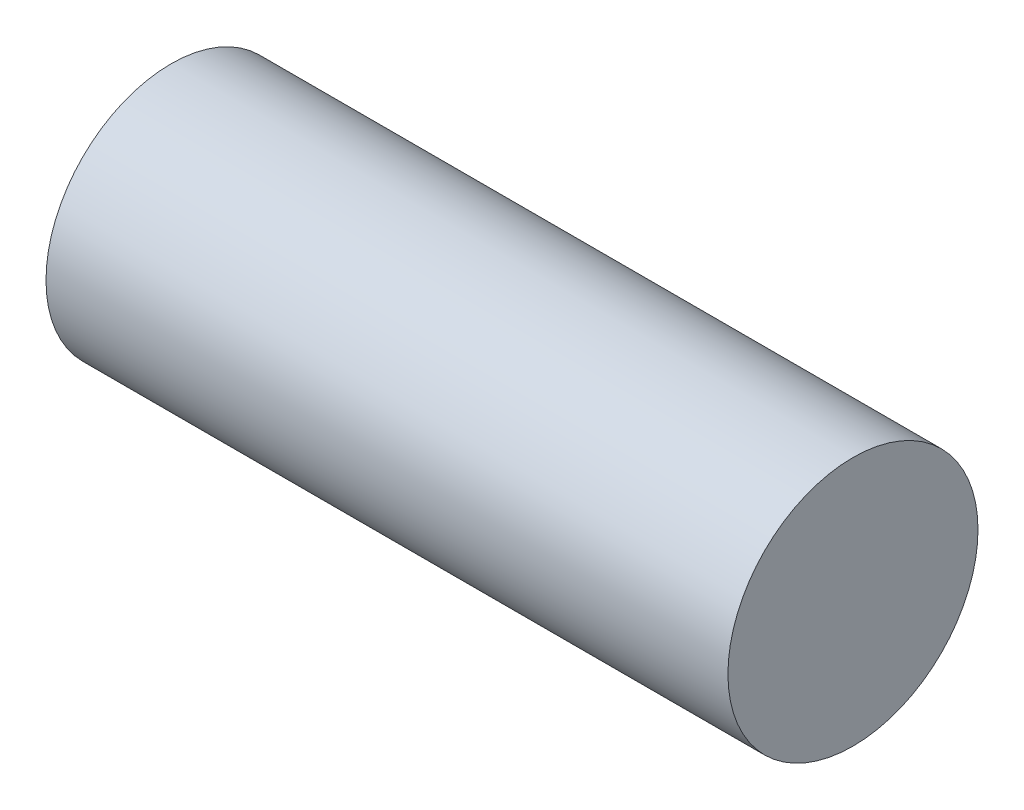
from build123d import *

# Parameters (mm, degrees)
SKETCH1_R           = 38.1
BOSS_EXTRUDE1_DEPTH = 210
CUT_EXTRUDE1_START  = -2.2
SKETCH2_R           = 38.1
CUT_EXTRUDE1_DEPTH  = 2.2


with BuildPart() as part:
    # Sketch1 → Boss-Extrude1 (new body)
    with BuildSketch(Plane(origin=(0, 0, 0), x_dir=(0, 0, -1), z_dir=(1, 0, 0))):
        Circle(SKETCH1_R)
    extrude(amount=BOSS_EXTRUDE1_DEPTH)

    # Sketch2 → Cut-Extrude1 (cut)
    with BuildSketch(Plane.ZY.offset(CUT_EXTRUDE1_START)):
        with Locations(Location((0, 0, 0), (0, 0, 180))):
            Circle(SKETCH2_R)
    extrude(amount=CUT_EXTRUDE1_DEPTH, mode=Mode.SUBTRACT)


solid = part.part
